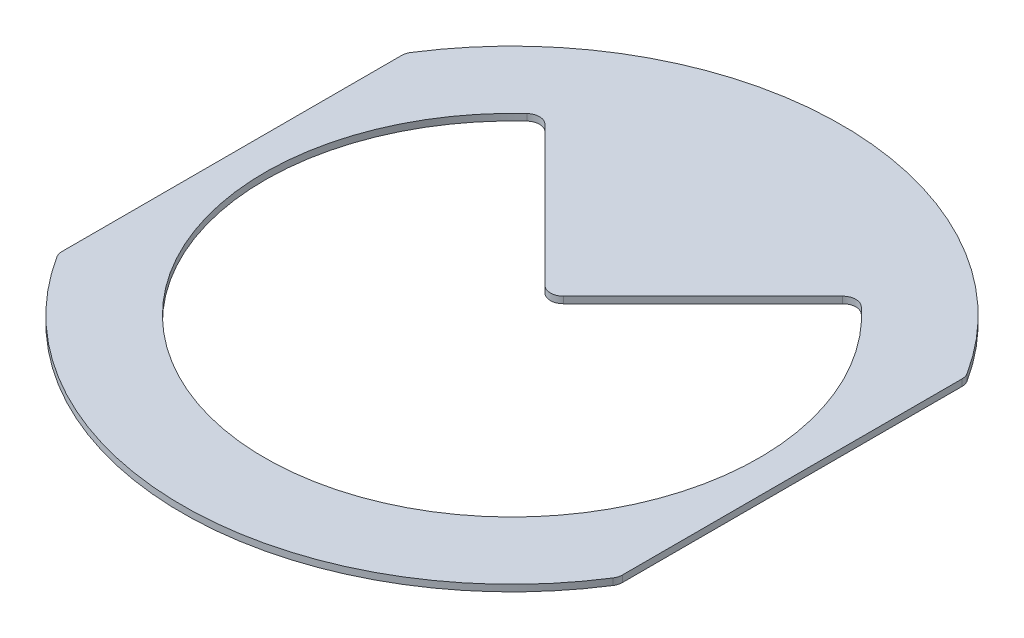
from build123d import *

# Parameters (mm, degrees)
BOSS_EXTRUDE1_DEPTH = 1
FILLET1_R           = 2


with BuildPart() as part:
    # Sketch1 → Boss-Extrude1 (new body)
    with BuildSketch(Plane(origin=(0, 0, 0), x_dir=(1, 0, 0), z_dir=(0, 1, 0))):
        with BuildLine():
            Line((-42.5, 26.339134382), (-42.5, -26.339134382))
            ThreePointArc((-42.5, -26.339134382), (0, -50), (42.5, -26.339134382))
            Line((42.5, -26.339134382), (42.5, 26.339134382))
            ThreePointArc((42.5, 26.339134382), (0, 50), (-42.5, 26.339134382))
        make_face()
        with BuildLine():
            Line((-23.898390102, 28.898390102), (0, 5))
            Line((0, 5), (23.898390102, 28.898390102))
            ThreePointArc((23.898390102, 28.898390102), (0, -37.5), (-23.898390102, 28.898390102))
        make_face(mode=Mode.SUBTRACT)
    extrude(amount=BOSS_EXTRUDE1_DEPTH)

    # Fillet1
    fillet1_edges = [part.edges().sort_by_distance(p)[0] for p in [
        (-23.898390102, 0.5, -28.898390102),
        (23.898390102, 0.5, -28.898390102),
        (0, 0.5, -5),
        (42.5, 0.5, -26.339134382),
        (42.5, 0.5, 26.339134382),
        (-42.5, 0.5, 26.339134382),
        (-42.5, 0.5, -26.339134382),
    ]]
    fillet(fillet1_edges, radius=FILLET1_R)


solid = part.part
